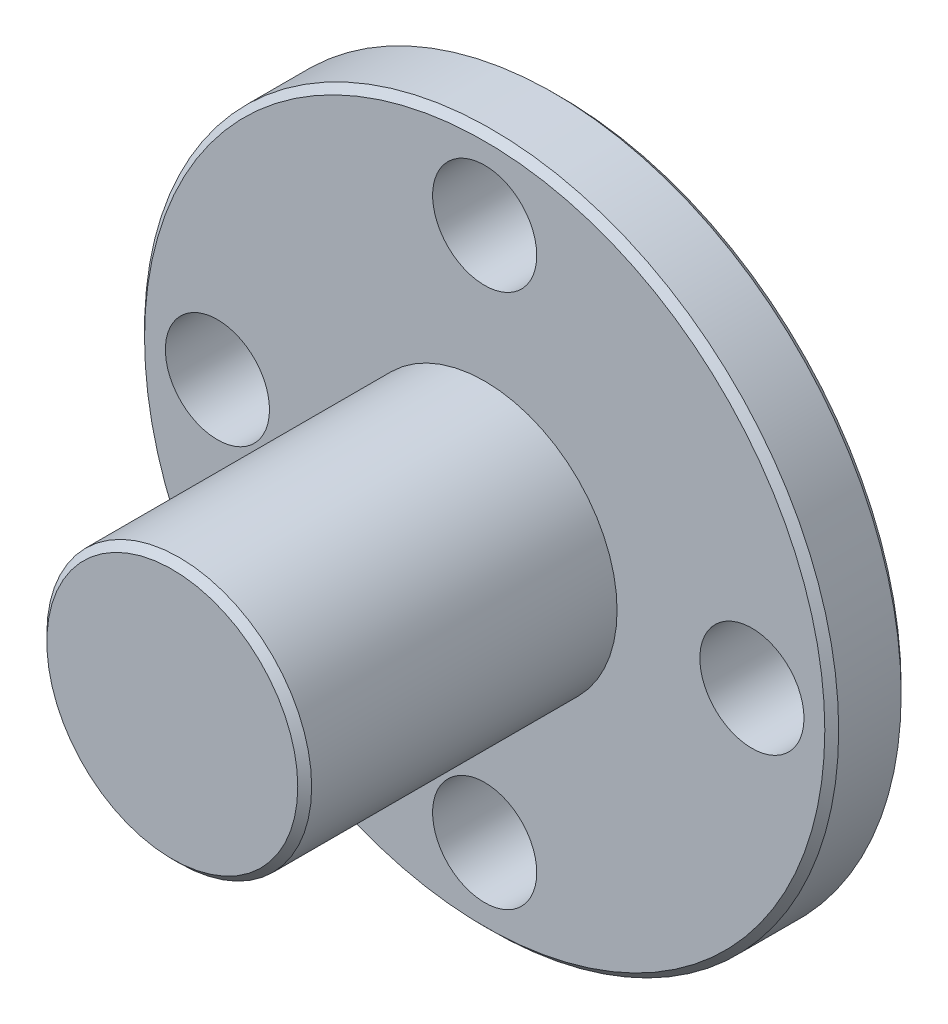
from build123d import *

# Parameters (mm, degrees)
SKETCH1_R           = 10
BOSS_EXTRUDE1_DEPTH = 2.2
SKETCH2_R           = 1.5
CUT_EXTRUDE1_DEPTH  = 15.31223253
SKETCH2_3_R         = 3.815
BOSS_EXTRUDE2_DEPTH = 9
CHAMFER1_SIZE       = 0.2


with BuildPart() as part:
    # Sketch1 → Boss-Extrude1 (new body)
    with BuildSketch(Plane.XY):
        Circle(SKETCH1_R)
    extrude(amount=BOSS_EXTRUDE1_DEPTH)

    # Sketch2 → Cut-Extrude1 (cut, through all)
    with BuildSketch(Plane.XY.offset(2.2)):
        with Locations((0, 7.7)):
            Circle(SKETCH2_R)
        with Locations((7.7, 0)):
            Circle(SKETCH2_R)
        with Locations((0, -7.7)):
            Circle(SKETCH2_R)
        with Locations((-7.7, 0)):
            Circle(SKETCH2_R)
    extrude(amount=-CUT_EXTRUDE1_DEPTH, mode=Mode.SUBTRACT)

    # Sketch2<3> → Boss-Extrude2 (add)
    with BuildSketch(Plane.XY.offset(2.2)):
        Circle(SKETCH2_3_R)
    extrude(amount=BOSS_EXTRUDE2_DEPTH)

    # Chamfer1
    chamfer1_edges = [part.edges().sort_by_distance(p)[0] for p in [
        (-3.815, 0, 11.2),
        (-10, 0, 2.2),
        (-10, 0, 0),
    ]]
    chamfer(chamfer1_edges, length=CHAMFER1_SIZE)


solid = part.part
